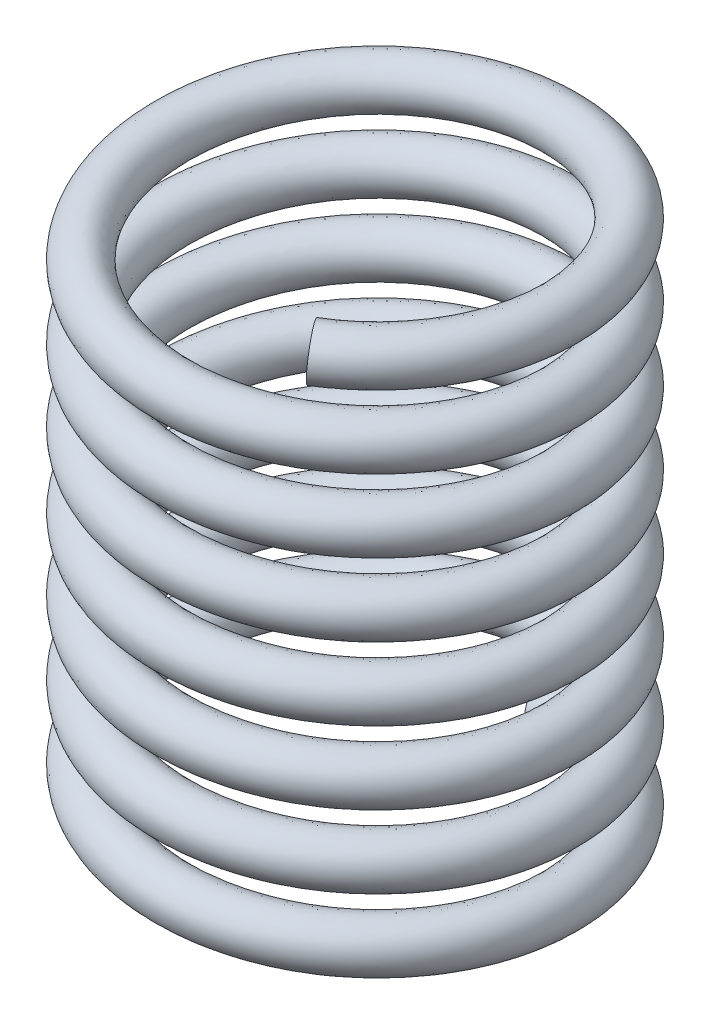
from build123d import *

# Parameters (mm, degrees)
SWEEP2_PITCH       = 1.5
SWEEP2_HEIGHT      = 11.1
SWEEP2_RADIUS      = 4
SWEEP2_START_ANGLE = -180
SKETCH2_R          = 0.5


with BuildPart() as part:
    # Sweep2: sweep along a helix
    with BuildLine() as sweep2_path:
        add(Helix(SWEEP2_PITCH, SWEEP2_HEIGHT, SWEEP2_RADIUS, center=(0, 0, 0), direction=(0, 1, 0), lefthand=True, mode=Mode.PRIVATE).rotate(Axis((0, 0, 0), (0, 1, 0)), SWEEP2_START_ANGLE))
    # Sketch2 → Sweep2 (sweep)
    with BuildSketch(Plane(origin=(2.351141009, 11.1, 3.236067978), x_dir=(-0.22152261206394744, -0.9526776602184286, -0.20816581867613704), z_dir=(-0.8075799436564887, 0.059577089017502076, 0.5867411738304917))):
        Circle(SKETCH2_R)
    sweep(path=sweep2_path.line, is_frenet=True)


solid = part.part
